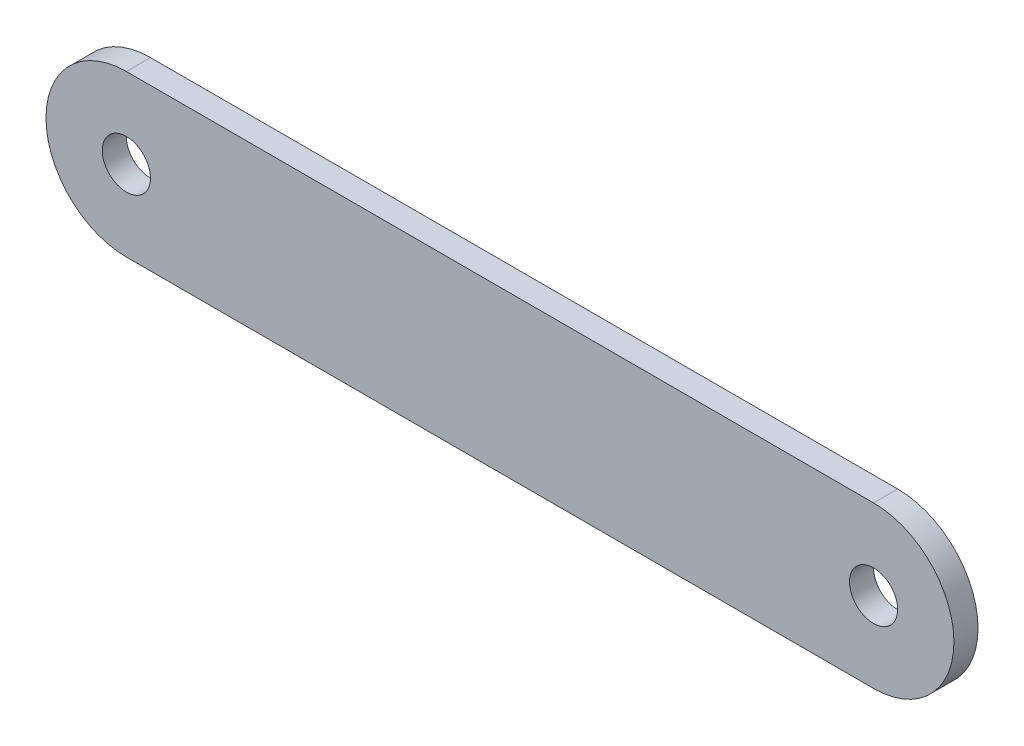
from build123d import *

# Parameters (mm, degrees)
ESQUISSE1_R        = 1.5
BOSS_EXTRU_1_DEPTH = 1.5


with BuildPart() as part:
    # Esquisse1 → Boss.-Extru.1 (new body)
    with BuildSketch(Plane.XY):
        with BuildLine():
            Line((0, 5), (46.5, 5))
            ThreePointArc((46.5, 5), (51.5, 0), (46.5, -5))
            Line((46.5, -5), (0, -5))
            ThreePointArc((0, -5), (-5, 0), (0, 5))
        make_face()
        Circle(ESQUISSE1_R, mode=Mode.SUBTRACT)
        with Locations((46.5, 0)):
            Circle(ESQUISSE1_R, mode=Mode.SUBTRACT)
    extrude(amount=BOSS_EXTRU_1_DEPTH)


solid = part.part
